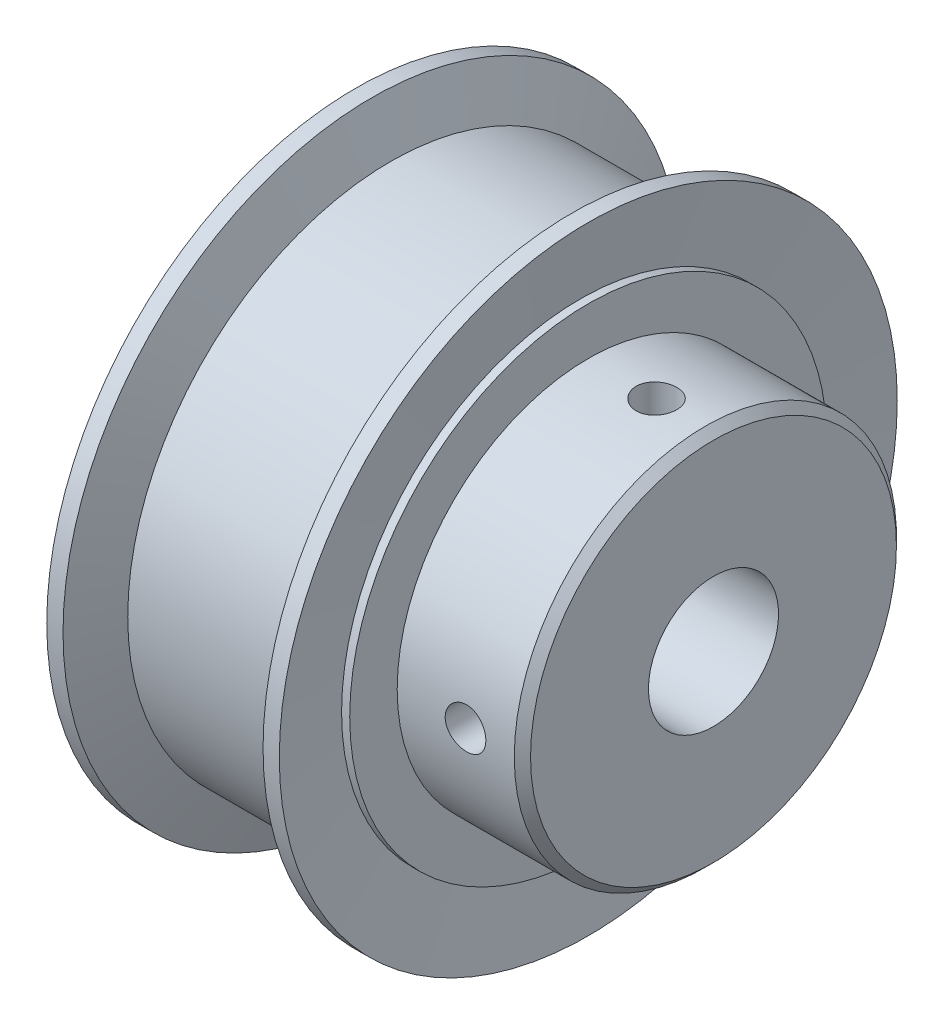
from build123d import *

# Parameters (mm, degrees)
CHAMFER1_SIZE          = 0.5
TROU_TARAUD_M30_REACH  = 42.606
TROU_TARAUD_M30_BORE_R = 1.25
CIRPATTERN1_COUNT      = 2
CIRPATTERN1_ANGLE      = 90


with BuildPart() as part:
    # Sketch1 → Revolve1 (revolve)
    with BuildSketch(Plane.XY, mode=Mode.PRIVATE) as revolve1_sk:
        Polygon((-7.15, 4), (-7.15, 14.67), (-6.65, 14.67), (-7.15, 19), (-6.15, 19), (-5, 16.17), (5, 16.17), (6.15, 19), (7.15, 19), (6.65, 14.67), (7.15, 14.67), (7.15, 11.75), (14.85, 11.75), (14.85, 4), align=None)
    revolve(revolve1_sk.sketch.rotate(Axis((0, 0, 0), (1, 0, 0)), 90), axis=Axis((0, 0, 0), (1, 0, 0)))

    # Chamfer1
    chamfer1_edges = [part.edges().sort_by_distance(p)[0] for p in [
        (14.85, 0, -11.75),
    ]]
    chamfer(chamfer1_edges, length=CHAMFER1_SIZE)

    # Trou taraudé M30 bore (on position points) → Trou taraudé M30 (cut, up to next)
    with BuildSketch(Plane(origin=(11.35, 0, 11.75), x_dir=(1, 0, 0), z_dir=(0, 0, 1)), mode=Mode.PRIVATE) as trou_taraud_m30_sk1:
        Circle(TROU_TARAUD_M30_BORE_R)
    trou_taraud_m30_tool1 = extrude(trou_taraud_m30_sk1.sketch, amount=-TROU_TARAUD_M30_REACH, mode=Mode.PRIVATE) & part.part
    trou_taraud_m30 = trou_taraud_m30_tool1.solids().sort_by_distance((11.35, 0, 11.75))[0]
    add(trou_taraud_m30, mode=Mode.SUBTRACT)

    # CirPattern1: Trou taraudé M30 ×2 about axis
    cirpattern1_axis = Axis((7.15, 0, 0), (-1, 0, 0))
    for i in range(1, CIRPATTERN1_COUNT):
        add(trou_taraud_m30.rotate(cirpattern1_axis, i * CIRPATTERN1_ANGLE / (CIRPATTERN1_COUNT - 1)), mode=Mode.SUBTRACT)


solid = part.part
